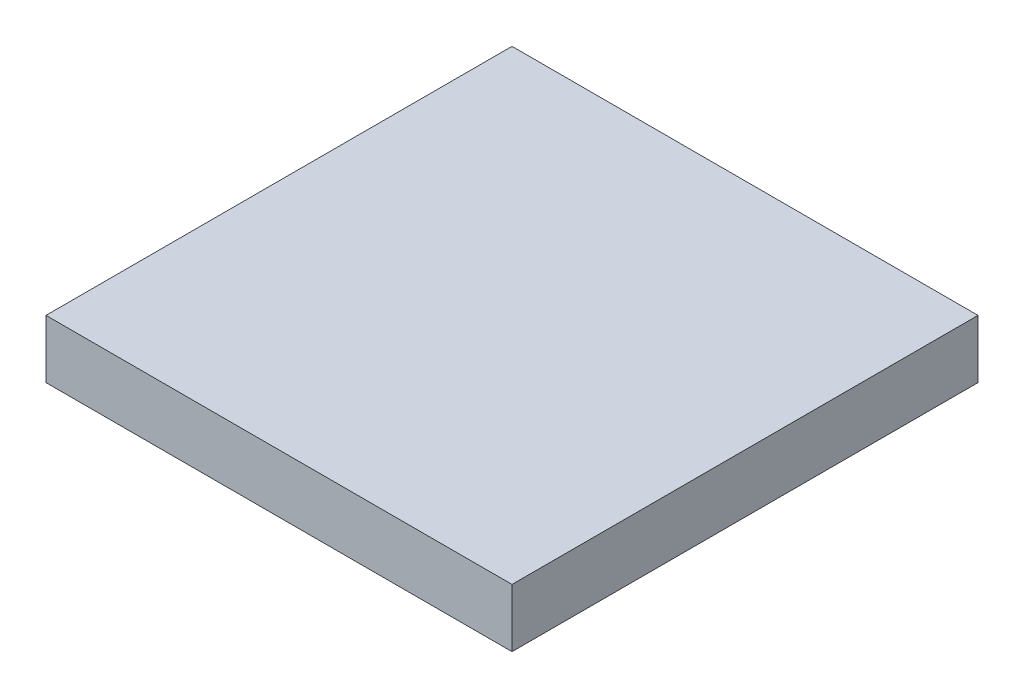
from build123d import *

# Parameters (mm, degrees)
SKETCH1_W           = 4
SKETCH1_H           = 4
BOSS_EXTRUDE1_DEPTH = 0.5


with BuildPart() as part:
    # Sketch1 → Boss-Extrude1 (new body)
    with BuildSketch(Plane(origin=(0, 0, 0), x_dir=(1, 0, 0), z_dir=(0, 1, 0))):
        Rectangle(SKETCH1_W, SKETCH1_H)
    extrude(amount=BOSS_EXTRUDE1_DEPTH)


solid = part.part
